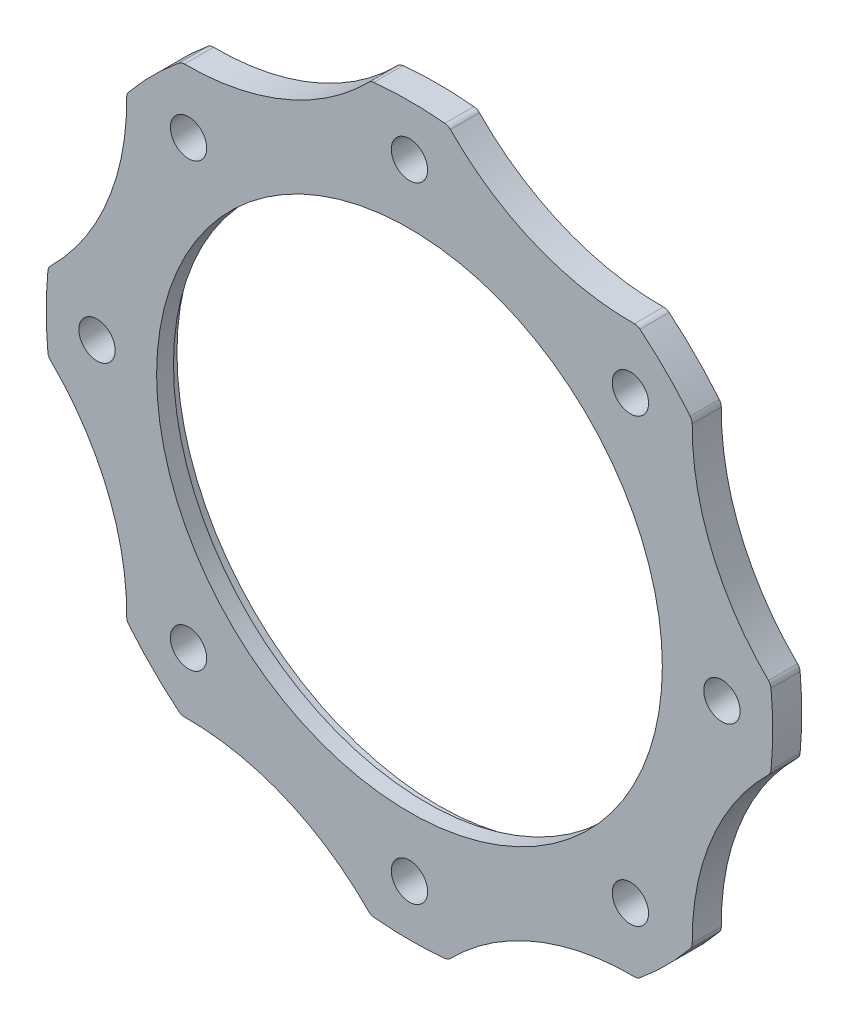
from build123d import *

# Parameters (mm, degrees)
SKETCH_1_R               = 125
SKETCH_1_R_2             = 87
SKETCH_1_R_3             = 6.25
EXTRUDE_1_DEPTH          = 10
CUT_EXTRUDE_3_DEPTH      = 178.059312096
PATTERN_CIRCULAR_1_COUNT = 8
SKETCH_4_R               = 90
CUT_EXTRUDE_4_DEPTH      = 4.2


with BuildPart() as part:
    # Эскиз1 → Бобышка-Вытянуть1 (new body)
    with BuildSketch(Plane.XY):
        Circle(SKETCH_1_R)
        with Locations(Location((0, 0, 0), (0, 0, 180))):
            Circle(SKETCH_1_R_2, mode=Mode.SUBTRACT)
        with Locations((76.013978978, 76.013978978)):
            Circle(SKETCH_1_R_3, mode=Mode.SUBTRACT)
        with Locations((107.5, 0)):
            Circle(SKETCH_1_R_3, mode=Mode.SUBTRACT)
        with Locations((76.013978978, -76.013978978)):
            Circle(SKETCH_1_R_3, mode=Mode.SUBTRACT)
        with Locations((0, -107.5)):
            Circle(SKETCH_1_R_3, mode=Mode.SUBTRACT)
        with Locations((-76.013978978, -76.013978978)):
            Circle(SKETCH_1_R_3, mode=Mode.SUBTRACT)
        with Locations((-107.5, 0)):
            Circle(SKETCH_1_R_3, mode=Mode.SUBTRACT)
        with Locations((-76.013978978, 76.013978978)):
            Circle(SKETCH_1_R_3, mode=Mode.SUBTRACT)
        with Locations((0, 107.5)):
            Circle(SKETCH_1_R_3, mode=Mode.SUBTRACT)
    extrude(amount=EXTRUDE_1_DEPTH)

    # Эскиз3 → Вырез-Вытянуть3 (cut, symmetric)
    with BuildSketch(Plane.XY.offset(10)):
        with BuildLine():
            ThreePointArc((-12.208800164, 124.402352062), (-13.211334731, 124.122533958), (-14.057918159, 123.517000946))
            ThreePointArc((-14.057918159, 123.517000946), (-43.051886141, 103.936447408), (-77.399259701, 97.28015822))
            ThreePointArc((-77.399259701, 97.28015822), (-78.426061083, 97.109709837), (-79.332821353, 96.598672124))
            ThreePointArc((-79.332821353, 96.598672124), (-47.835429046, 115.484941564), (-12.208800164, 124.402352062))
        make_face()
    cut_extrude_3 = extrude(amount=CUT_EXTRUDE_3_DEPTH, both=True, mode=Mode.SUBTRACT)

    # Круговой массив1: Вырез-Вытянуть3 ×8 about axis
    pattern_circular_1_axis = Axis((0, 0, 0), (0, 0, -1))
    for i in range(1, PATTERN_CIRCULAR_1_COUNT):
        add(cut_extrude_3.rotate(pattern_circular_1_axis, i * 360 / PATTERN_CIRCULAR_1_COUNT), mode=Mode.SUBTRACT)

    # Эскиз4 → Вырез-Вытянуть4 (cut)
    with BuildSketch(Plane(origin=(0, 0, 0), x_dir=(-1, 0, 0), z_dir=(0, 0, -1))):
        Circle(SKETCH_4_R)
    extrude(amount=-CUT_EXTRUDE_4_DEPTH, mode=Mode.SUBTRACT)


solid = part.part
